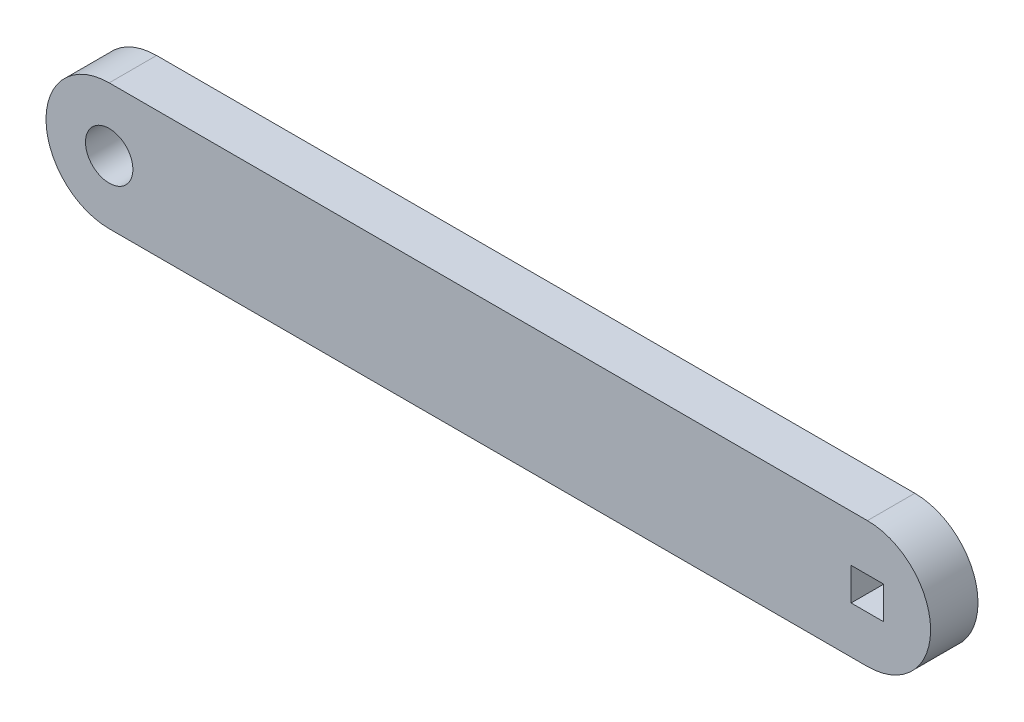
from build123d import *

# Parameters (mm, degrees)
SKETCH1_R           = 2.38125
SKETCH1_W           = 3.2766
SKETCH1_H           = 3.2766
BOSS_EXTRUDE1_DEPTH = 4.7625


with BuildPart() as part:
    # Sketch1 → Boss-Extrude1 (new body)
    with BuildSketch(Plane.XY):
        with BuildLine():
            Line((0, 6.35), (76.2, 6.35))
            ThreePointArc((76.2, 6.35), (82.55, 0), (76.2, -6.35))
            Line((76.2, -6.35), (0, -6.35))
            ThreePointArc((0, -6.35), (-6.35, 0), (0, 6.35))
        make_face()
        with Locations(Location((0, 0, 0), (0, 0, 180))):
            Circle(SKETCH1_R, mode=Mode.SUBTRACT)
        with Locations((76.2, 0)):
            Rectangle(SKETCH1_W, SKETCH1_H, mode=Mode.SUBTRACT)
    extrude(amount=BOSS_EXTRUDE1_DEPTH)


solid = part.part
